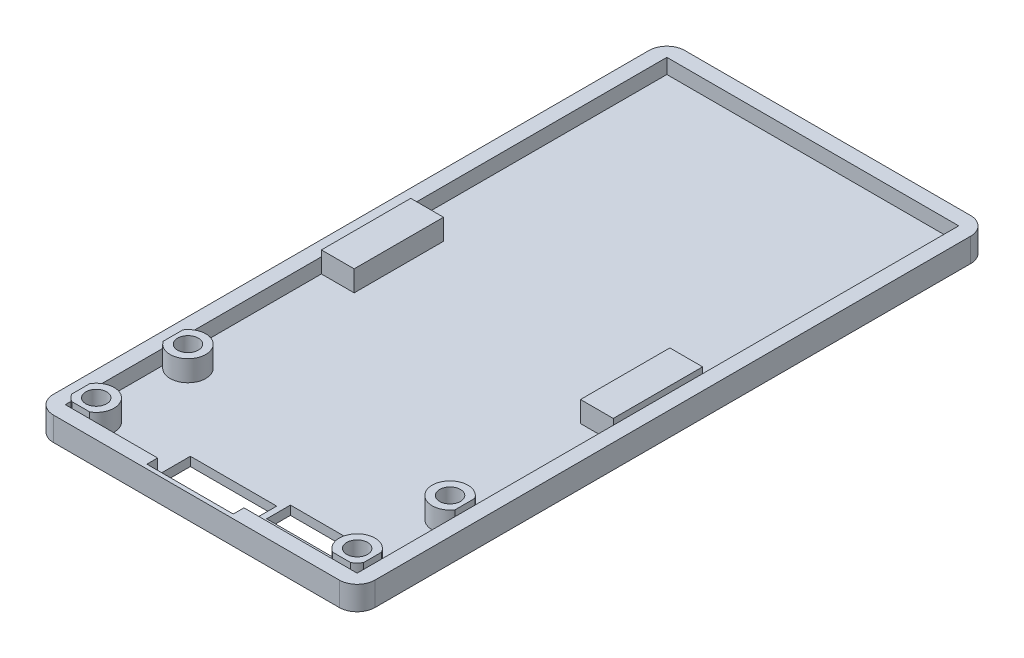
from build123d import *

# Parameters (mm, degrees)
SKETCH1_W           = 49
SKETCH1_H           = 101
BOSS_EXTRUDE1_DEPTH = 1.5
SKETCH2_W           = 54
SKETCH2_H           = 106
SKETCH2_W_2         = 49
SKETCH2_H_2         = 101
BOSS_EXTRUDE2_DEPTH = 4
SKETCH3_W           = 5.5
SKETCH3_H           = 15
BOSS_EXTRUDE3_DEPTH = 5
SKETCH4_R           = 1.75
CUT_EXTRUDE1_DEPTH  = 4.25
SKETCH5_R           = 1.75
CUT_EXTRUDE2_DEPTH  = 4.25
SKETCH6_W           = 14.5
SKETCH6_H           = 7.3
CUT_EXTRUDE3_DEPTH  = 60.690870324
SKETCH7_W           = 11.8
SKETCH7_H           = 4
CUT_EXTRUDE4_DEPTH  = 60.690870324
FILLET1_R           = 3


with BuildPart() as part:
    # Sketch1 → Boss-Extrude1 (new body)
    with BuildSketch(Plane(origin=(0, 0, 0), x_dir=(1, 0, 0), z_dir=(0, 1, 0))):
        Rectangle(SKETCH1_W, SKETCH1_H)
    extrude(amount=BOSS_EXTRUDE1_DEPTH)

    # Sketch2 → Boss-Extrude2 (add)
    with BuildSketch(Plane(origin=(0, 0, 0), x_dir=(1, 0, 0), z_dir=(0, 1, 0))):
        Rectangle(SKETCH2_W, SKETCH2_H)
        Rectangle(SKETCH2_W_2, SKETCH2_H_2, mode=Mode.SUBTRACT)
    extrude(amount=BOSS_EXTRUDE2_DEPTH)

    # Sketch3 → Boss-Extrude3 (add)
    with BuildSketch(Plane(origin=(0, 0, 0), x_dir=(1, 0, 0), z_dir=(0, 1, 0))):
        with BuildLine():
            Line((-24.5, -30.741687605), (-24.5, -34.058312395))
            ThreePointArc((-24.5, -34.058312395), (-19, -32.4), (-24.5, -30.741687605))
        make_face()
        with Locations((-21.75, 0)):
            Rectangle(SKETCH3_W, SKETCH3_H)
        with BuildLine():
            Line((-24.5, -46.403337045), (-24.5, -49.396662955))
            ThreePointArc((-24.5, -49.396662955), (-24.021320344, -50.021320344), (-23.396662955, -50.5))
            Line((-23.396662955, -50.5), (-20.403337045, -50.5))
            ThreePointArc((-20.403337045, -50.5), (-19.778679656, -45.778679656), (-24.5, -46.403337045))
        make_face()
    boss_extrude3 = extrude(amount=BOSS_EXTRUDE3_DEPTH)

    # Mirror1: Boss-Extrude3 across plane
    add(boss_extrude3.mirror(Plane(origin=(0, 0, 0), x_dir=(0, 0, 1), z_dir=(1, 0, 0))))

    # Sketch4 → Cut-Extrude1 (cut)
    with BuildSketch(Plane(origin=(0, 5, 0), x_dir=(1, 0, 0), z_dir=(0, 1, 0))):
        with Locations(Location((-21.9, -47.9, 0), (0, 0, 270))):
            Circle(SKETCH4_R)
        with Locations(Location((21.9, -47.9, 0), (0, 0, 270))):
            Circle(SKETCH4_R)
    extrude(amount=-CUT_EXTRUDE1_DEPTH, mode=Mode.SUBTRACT)

    # Sketch5 → Cut-Extrude2 (cut)
    with BuildSketch(Plane(origin=(0, 5, 0), x_dir=(1, 0, 0), z_dir=(0, 1, 0))):
        with Locations(Location((-22, -32.4, 0), (0, 0, 270))):
            Circle(SKETCH5_R)
        with Locations(Location((22, -32.4, 0), (0, 0, 270))):
            Circle(SKETCH5_R)
    extrude(amount=-CUT_EXTRUDE2_DEPTH, mode=Mode.SUBTRACT)

    # Sketch6 → Cut-Extrude3 (cut, through all)
    with BuildSketch(Plane(origin=(0, 0, 0), x_dir=(1, 0, 0), z_dir=(0, 1, 0))):
        with Locations((-1.75, -48.65)):
            Rectangle(SKETCH6_W, SKETCH6_H)
    extrude(amount=CUT_EXTRUDE3_DEPTH, mode=Mode.SUBTRACT)

    # Sketch7 → Cut-Extrude4 (cut, through all)
    with BuildSketch(Plane(origin=(0, 0, 0), x_dir=(1, 0, 0), z_dir=(0, 1, 0))):
        with Locations((12.4, -45.7)):
            Rectangle(SKETCH7_W, SKETCH7_H)
    extrude(amount=CUT_EXTRUDE4_DEPTH, mode=Mode.SUBTRACT)

    # Fillet1
    fillet1_edges = [part.edges().sort_by_distance(p)[0] for p in [
        (-27, 2, 53),
        (27, 2, 53),
        (27, 2, -53),
        (-27, 2, -53),
    ]]
    fillet(fillet1_edges, radius=FILLET1_R)


solid = part.part
